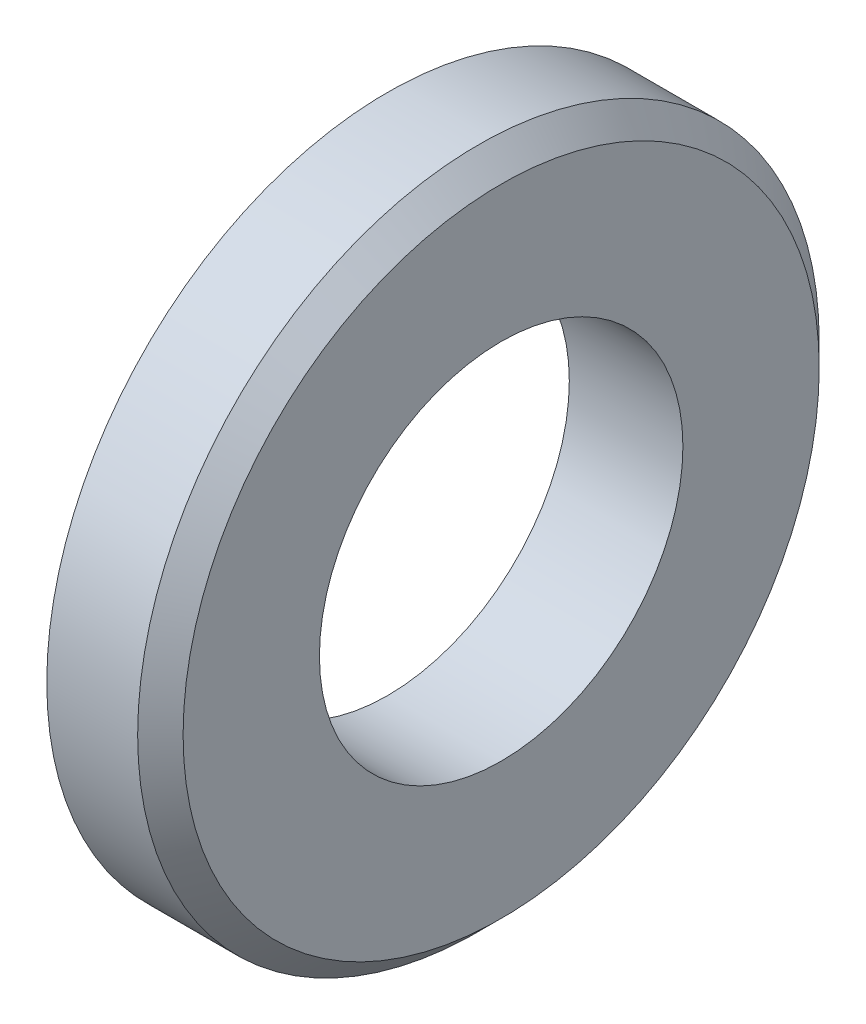
from build123d import *

# Parameters (mm, degrees)
SKETCH2_R           = 30
BOSS_EXTRUDE1_DEPTH = 10
CHAMFER1_SIZE       = 2
SKETCH3_R           = 16
CUT_EXTRUDE1_DEPTH  = 10


with BuildPart() as part:
    # Sketch2 → Boss-Extrude1 (new body)
    with BuildSketch(Plane(origin=(0, 0, 0), x_dir=(0, 0, -1), z_dir=(1, 0, 0))):
        Circle(SKETCH2_R)
    extrude(amount=BOSS_EXTRUDE1_DEPTH)

    # Chamfer1
    chamfer1_edges = [part.edges().sort_by_distance(p)[0] for p in [
        (10, 0, 30),
    ]]
    chamfer(chamfer1_edges, length=CHAMFER1_SIZE)

    # Sketch3 → Cut-Extrude1 (cut)
    with BuildSketch(Plane(origin=(10, 0, 0), x_dir=(0, 0, -1), z_dir=(1, 0, 0))):
        Circle(SKETCH3_R)
    extrude(amount=-CUT_EXTRUDE1_DEPTH, mode=Mode.SUBTRACT)


solid = part.part
